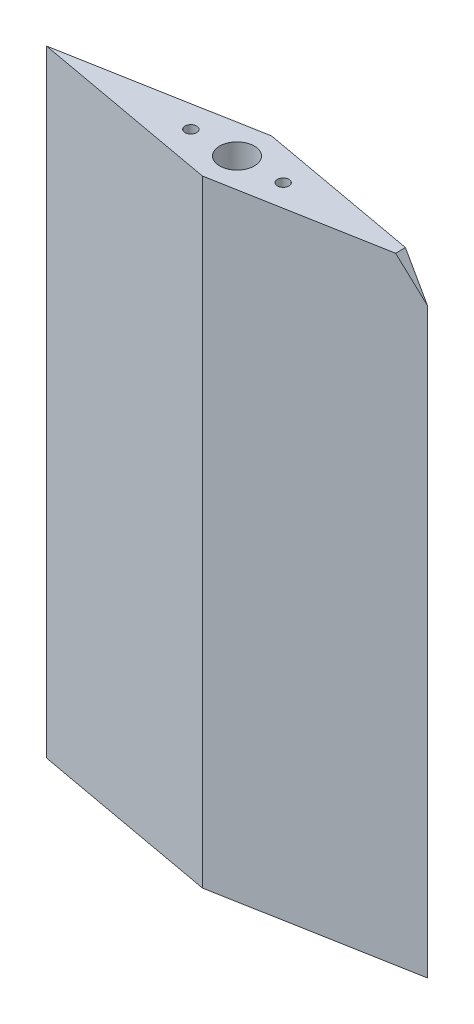
from build123d import *

# Parameters (mm, degrees)
BOSS_EXTRUDE1_DEPTH      = 9.525
BOSS_EXTRUDE1_DEPTH_BACK = 9.525
CUT_EXTRUDE1_DEPTH       = 373.680910299
CUT_EXTRUDE2_DEPTH       = 373.680910299
SKETCH5_W                = 97.518379051
SKETCH5_H                = 136.419580789
CUT_EXTRUDE3_DEPTH       = 739.741184154
SKETCH6_W                = 75.100700845
SKETCH6_H                = 154.277977479
CUT_EXTRUDE4_DEPTH       = 748.678846608
SKETCH7_R                = 4.7625
CUT_EXTRUDE5_DEPTH       = 254
CUT_EXTRUDE6_DEPTH       = 752.699804454
CUT_EXTRUDE6_DEPTH_BACK  = 752.699804454
SKETCH9_R                = 1.5875
CUT_EXTRUDE7_DEPTH       = 12.7
CUT_EXTRUDE8_START       = -12.7
SKETCH10_R               = 1.5875
CUT_EXTRUDE8_DEPTH       = 12.7


with BuildPart() as part:
    # Sketch1 → Boss-Extrude1 (new, two sides: drawn at the far end of the back side and taken through both)
    with BuildSketch(Plane.XY.offset(-BOSS_EXTRUDE1_DEPTH_BACK)):
        Polygon((101.792411443, 735.656458749), (49.404911443, 673.557276224), (49.404911443, 396.497366015), (154.179911443, 396.497366015), (154.179911443, 556.636391043), (128.683999881, 589.063224066), (151.148766449, 589.063224066), (128.683999881, 617.634912224), (151.148766449, 617.634912224), (129.452026088, 645.229790529), (151.148766449, 645.229790529), (128.876006433, 673.557276224), (154.179911443, 673.557276224), align=None)
    extrude(amount=BOSS_EXTRUDE1_DEPTH + BOSS_EXTRUDE1_DEPTH_BACK)

    # Sketch2 → Cut-Extrude1 (cut, through all)
    with BuildSketch(Plane(origin=(0, 396.497366015, 0), x_dir=(-1, 0, 0), z_dir=(0, -1, 0))):
        Polygon((-49.404911443, 0), (-101.792411443, -9.525), (-154.179911443, 0), (-159.65732669, 0), (-159.65732669, -13.649148588), (-44.158493861, -13.649148588), (-44.158493861, 0), align=None)
    extrude(amount=-CUT_EXTRUDE1_DEPTH, mode=Mode.SUBTRACT)

    # Sketch3 → Cut-Extrude2 (cut, through all)
    with BuildSketch(Plane.XZ.offset(-396.497366015)):
        Polygon((49.404911443, 0), (101.792411443, -9.525), (154.179911443, 0), (159.580570647, 0), (159.580570647, -14.500746269), (43.682013433, -14.500746269), (43.682013433, 0), align=None)
    extrude(amount=-CUT_EXTRUDE2_DEPTH, mode=Mode.SUBTRACT)

    # Sketch5 → Cut-Extrude3 (cut, through all)
    with BuildSketch(Plane(origin=(26.430459561, 22.297003663, 133.782021979), x_dir=(0.9815360247212257, -0.031445805879602766, -0.1886748352776165), z_dir=(0.1912773697394791, 0.16136352846789567, 0.9681811708073739))):
        with Locations((89.248369642, 700.742830845)):
            Rectangle(SKETCH5_W, SKETCH5_H)
    cut_extrude3 = extrude(amount=CUT_EXTRUDE3_DEPTH, mode=Mode.SUBTRACT)

    # Sketch6 → Cut-Extrude4 (cut, through all)
    with BuildSketch(Plane(origin=(-18.981895096, 16.01331916, 96.079914958), x_dir=(0.9815360247212258, 0.03144580587960229, 0.18867483527761636), z_dir=(-0.19127736973947887, 0.1613635284678934, 0.9681811708073744))):
        with Locations((98.873573013, 697.792784398)):
            Rectangle(SKETCH6_W, SKETCH6_H)
    cut_extrude4 = extrude(amount=CUT_EXTRUDE4_DEPTH, mode=Mode.SUBTRACT)

    # Mirror1: Cut-Extrude3, Cut-Extrude4 across plane
    add(cut_extrude3.mirror(Plane.XY), mode=Mode.SUBTRACT)
    add(cut_extrude4.mirror(Plane.XY), mode=Mode.SUBTRACT)

    # Sketch7 → Cut-Extrude5 (cut)
    with BuildSketch(Plane.XZ.offset(-396.497366015)):
        with Locations((101.792411443, 0)):
            Circle(SKETCH7_R)
    extrude(amount=-CUT_EXTRUDE5_DEPTH, mode=Mode.SUBTRACT)

    # Sketch8 → Cut-Extrude6 (cut, two sides: drawn at the far end of the back side and taken through both)
    with BuildSketch(Plane.XY.offset(-CUT_EXTRUDE6_DEPTH_BACK)):
        Polygon((-21.644649604, 762.380461852), (-21.644649604, 566.076912382), (101.792411443, 566.076912382), (201.352960681, 566.076912382), (201.352960681, 762.380461852), align=None)
    extrude(amount=CUT_EXTRUDE6_DEPTH + CUT_EXTRUDE6_DEPTH_BACK, mode=Mode.SUBTRACT)

    # Sketch9 → Cut-Extrude7 (cut)
    with BuildSketch(Plane(origin=(0, 566.076912382, 0), x_dir=(1, 0, 0), z_dir=(0, 1, 0))):
        with Locations((89.092411443, 0)):
            Circle(SKETCH9_R)
        with Locations((114.492411443, 0)):
            Circle(SKETCH9_R)
    extrude(amount=-CUT_EXTRUDE7_DEPTH, mode=Mode.SUBTRACT)

    # Sketch10 → Cut-Extrude8 (cut)
    with BuildSketch(Plane.XZ.offset(-396.497366015).offset(CUT_EXTRUDE8_START)):
        with Locations((89.092411443, 0)):
            Circle(SKETCH10_R)
        with Locations((114.492411443, 0)):
            Circle(SKETCH10_R)
    extrude(amount=CUT_EXTRUDE8_DEPTH, mode=Mode.SUBTRACT)


solid = part.part
